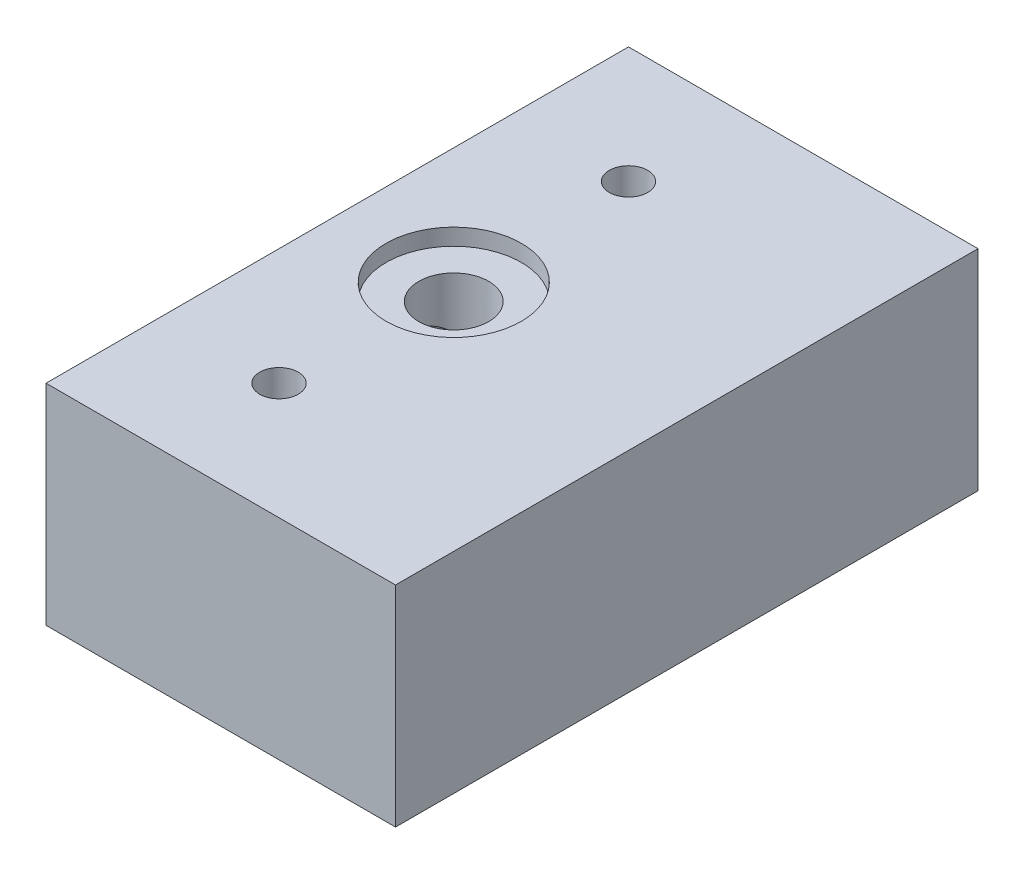
from build123d import *

# Parameters (mm, degrees)
SKETCH1_W                    = 50
SKETCH1_H                    = 18
BOSS_EXTRUDE1_DEPTH          = 30
F_6_0_6_DIAMETER_HOLE1_D     = 6
F_6_0_6_DIAMETER_HOLE1_DEPTH = 12
F_6_0_6_DIAMETER_HOLE1_TIP   = 1.802581857
F_6_0_6_DIAMETER_HOLE2_D     = 6
F_6_0_6_DIAMETER_HOLE2_DEPTH = 8
F_6_0_6_DIAMETER_HOLE2_TIP   = 1.802581857
SKETCH5_R                    = 5.805
CUT_EXTRUDE1_DEPTH           = 1.424


with BuildPart() as part:
    # Sketch1 → Boss-Extrude1 (new body)
    with BuildSketch(Plane(origin=(0, 0, 0), x_dir=(0, 0, -1), z_dir=(1, 0, 0))):
        with Locations((0, 9)):
            Rectangle(SKETCH1_W, SKETCH1_H)
    extrude(amount=BOSS_EXTRUDE1_DEPTH)

    # Ø6.0 (6) Diameter Hole1
    with Locations(Plane(origin=(0, 10, 0), x_dir=(0, 0, -1), z_dir=(-1, 0, 0))):
        with Locations((0, 0)):
            Hole(F_6_0_6_DIAMETER_HOLE1_D / 2, depth=F_6_0_6_DIAMETER_HOLE1_DEPTH)
            with Locations((0, 0, -(F_6_0_6_DIAMETER_HOLE1_DEPTH + F_6_0_6_DIAMETER_HOLE1_TIP / 2))):  # 118° drill point
                Cone(0, F_6_0_6_DIAMETER_HOLE1_D / 2, F_6_0_6_DIAMETER_HOLE1_TIP, mode=Mode.SUBTRACT)

    # Sketch4 → M3x0.5 Tapped Hole1 (revolve, cut)
    with BuildSketch(Plane(origin=(0, 10, -10), x_dir=(0, 0, 1), z_dir=(0, 1, 0))):
        Polygon((0, 0), (0, 12.251075774), (1.25, 11.5), (1.25, 0), align=None)
    m3x0_5_tapped_hole1 = revolve(axis=Axis((-6.35, 10, -10), (1, 0, 0)), mode=Mode.SUBTRACT)

    # Mirror1: M3x0.5 Tapped Hole1 across plane
    add(m3x0_5_tapped_hole1.mirror(Plane.XY), mode=Mode.SUBTRACT)

    # Ø6.0 (6) Diameter Hole2
    with Locations(Plane(origin=(10, 18, 0), x_dir=(0, 0, 1), z_dir=(0, 1, 0))):
        with Locations((0, 0)):
            Hole(F_6_0_6_DIAMETER_HOLE2_D / 2, depth=F_6_0_6_DIAMETER_HOLE2_DEPTH)
            with Locations((0, 0, -(F_6_0_6_DIAMETER_HOLE2_DEPTH + F_6_0_6_DIAMETER_HOLE2_TIP / 2))):  # 118° drill point
                Cone(0, F_6_0_6_DIAMETER_HOLE2_D / 2, F_6_0_6_DIAMETER_HOLE2_TIP, mode=Mode.SUBTRACT)

    # Sketch5 → Cut-Extrude1 (cut)
    with BuildSketch(Plane(origin=(0, 18, 0), x_dir=(1, 0, 0), z_dir=(0, 1, 0))):
        with Locations(Location((10, 0, 0), (0, 0, 270))):
            Circle(SKETCH5_R)
    extrude(amount=-CUT_EXTRUDE1_DEPTH, mode=Mode.SUBTRACT)

    # Sketch9 → M4x0.7 Tapped Hole1 (revolve, cut)
    with BuildSketch(Plane(origin=(10, 18, -15), x_dir=(0, 0, 1), z_dir=(1, 0, 0))):
        Polygon((0, 0), (0, 15.091420021), (1.65, 14.1), (1.65, 0), align=None)
    m4x0_7_tapped_hole1 = revolve(axis=Axis((10, 24.35, -15), (0, -1, 0)), mode=Mode.SUBTRACT)

    # Mirror2: M4x0.7 Tapped Hole1 across plane
    add(m4x0_7_tapped_hole1.mirror(Plane.XY), mode=Mode.SUBTRACT)


solid = part.part
